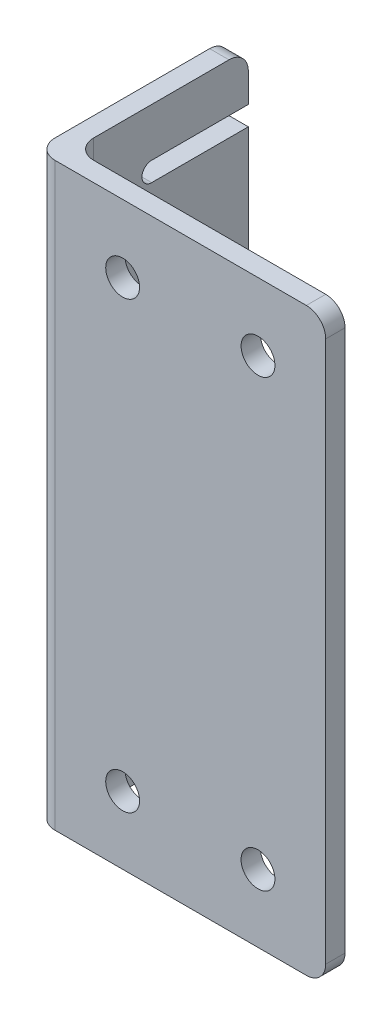
from build123d import *

# Parameters (mm, degrees)
BOSS_EXTRU_1_DEPTH      = 60
ENL_V_MAT_EXTRU_1_DEPTH = 71
ESQUISSE3_R             = 1.75
ENL_V_MAT_EXTRU_2_DEPTH = 70.455021417
CONG_1_R                = 2


with BuildPart() as part:
    # Esquisse1 → Boss.-Extru.1 (new body)
    with BuildSketch(Plane(origin=(0, 0, 0), x_dir=(1, 0, 0), z_dir=(0, 1, 0))):
        Polygon((30, 0), (0, 0), (0, 20), (2, 20), (2, 2), (30, 2), align=None)
    extrude(amount=BOSS_EXTRU_1_DEPTH)

    # Esquisse2 → Enlèv. mat.-Extru.1 (cut, through all)
    with BuildSketch(Plane.ZY):
        with BuildLine():
            Line((-20, 55), (-10, 55))
            ThreePointArc((-10, 55), (-9, 54), (-10, 53))
            Line((-10, 53), (-20, 53))
            Line((-20, 53), (-20, 55))
        make_face()
        with BuildLine():
            Line((-20, 5), (-10, 5))
            ThreePointArc((-10, 5), (-9, 6), (-10, 7))
            Line((-10, 7), (-20, 7))
            Line((-20, 7), (-20, 5))
        make_face()
    extrude(amount=-ENL_V_MAT_EXTRU_1_DEPTH, mode=Mode.SUBTRACT)

    # Esquisse3 → Enlèv. mat.-Extru.2 (cut, through all)
    with BuildSketch(Plane(origin=(0, 0, -2), x_dir=(-1, 0, 0), z_dir=(0, 0, -1))):
        with Locations((-23, 53)):
            Circle(ESQUISSE3_R)
        with Locations((-9, 53)):
            Circle(ESQUISSE3_R)
        with Locations((-9, 7)):
            Circle(ESQUISSE3_R)
        with Locations((-23, 7)):
            Circle(ESQUISSE3_R)
    extrude(amount=-ENL_V_MAT_EXTRU_2_DEPTH, mode=Mode.SUBTRACT)

    # Congé1
    cong_1_edges = [part.edges().sort_by_distance(p)[0] for p in [
        (0, 30, 0),
        (2, 30, -2),
        (1, 60, -20),
        (30, 60, -1),
        (1, 0, -20),
        (30, 0, -1),
    ]]
    fillet(cong_1_edges, radius=CONG_1_R)


solid = part.part
